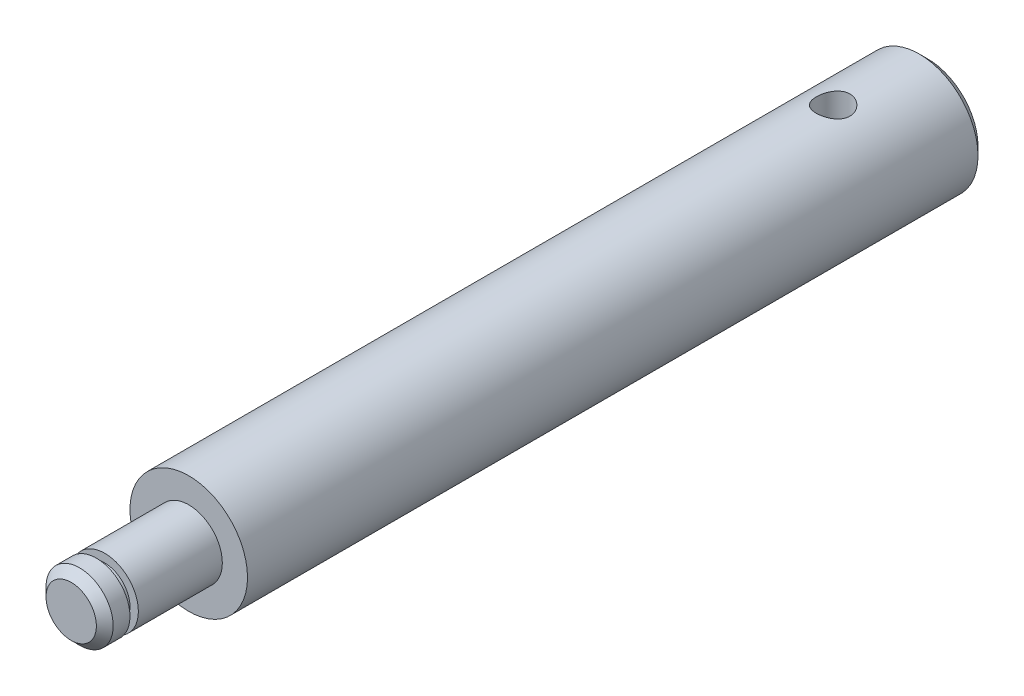
from build123d import *

# Parameters (mm, degrees)
ESQUISSE1_R                   = 3.5
BOSS_EXTRU_1_DEPTH            = 44
ESQUISSE2_R                   = 2
BOSS_EXTRU_2_DEPTH            = 5
ESQUISSE3_R                   = 1.5
BOSS_EXTRU_3_DEPTH            = 0.5
ESQUISSE4_R                   = 2
BOSS_EXTRU_4_DEPTH            = 1.5
CHANFREIN1_SIZE               = 0.5
CHANFREIN2_SIZE               = 0.5
DIAM_TRE_DU_PER_AGE_2_0_2_3_D = 2


with BuildPart() as part:
    # Esquisse1 → Boss.-Extru.1 (new body)
    with BuildSketch(Plane.XY):
        Circle(ESQUISSE1_R)
    extrude(amount=BOSS_EXTRU_1_DEPTH)

    # Esquisse2 → Boss.-Extru.2 (add)
    with BuildSketch(Plane.XY.offset(44)):
        Circle(ESQUISSE2_R)
    extrude(amount=BOSS_EXTRU_2_DEPTH)

    # Esquisse3 → Boss.-Extru.3 (add)
    with BuildSketch(Plane.XY.offset(49)):
        Circle(ESQUISSE3_R)
    extrude(amount=BOSS_EXTRU_3_DEPTH)

    # Esquisse4 → Boss.-Extru.4 (add)
    with BuildSketch(Plane.XY.offset(49.5)):
        Circle(ESQUISSE4_R)
    extrude(amount=BOSS_EXTRU_4_DEPTH)

    # Chanfrein1
    chanfrein1_edges = [part.edges().sort_by_distance(p)[0] for p in [
        (-2, 0, 51),
    ]]
    chamfer(chanfrein1_edges, length=CHANFREIN1_SIZE)

    # Chanfrein2
    chanfrein2_edges = [part.edges().sort_by_distance(p)[0] for p in [
        (-3.5, 0, 0),
    ]]
    chamfer(chanfrein2_edges, length=CHANFREIN2_SIZE)

    # Diamètre du perçage Ø2.0 (2)3 (through all)
    with Locations(Plane(origin=(0, 3.5, 5.625), x_dir=(1, 0, 0), z_dir=(0, 1, 0))):
        with Locations((0, 0)):
            Hole(DIAM_TRE_DU_PER_AGE_2_0_2_3_D / 2)


solid = part.part
